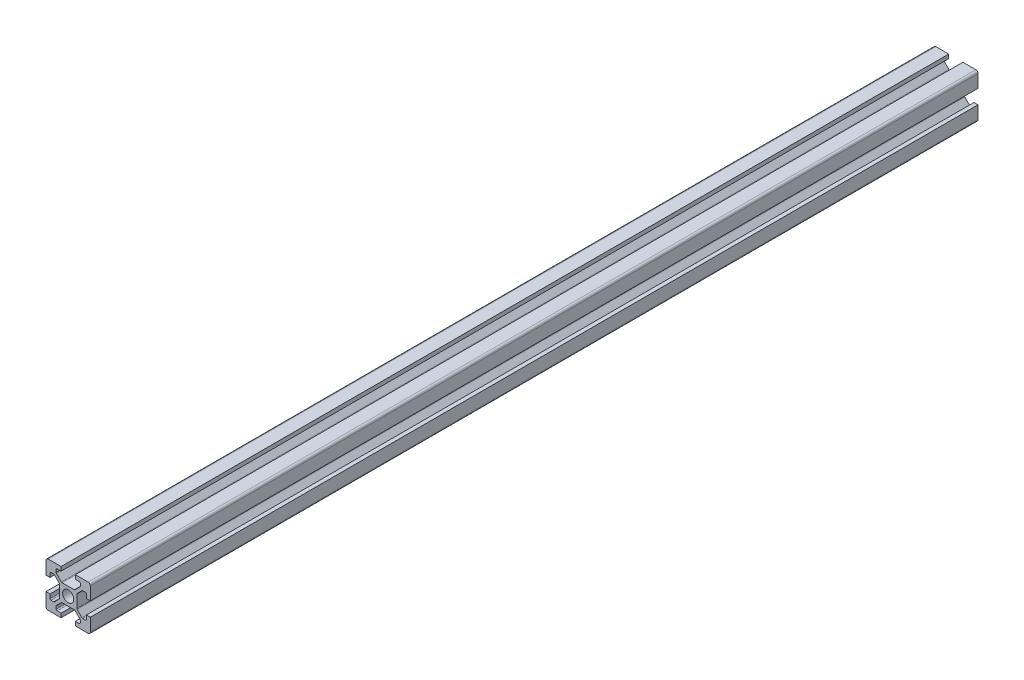
from build123d import *

# Parameters (mm, degrees)
SKETCH1_R           = 2.5
BOSS_EXTRUDE1_DEPTH = 400
FILLET1_R           = 1
FILLET2_R           = 0.5
FILLET3_R           = 0.5
FILLET4_R           = 0.5
FILLET5_R           = 0.5
CUT_EXTRUDE1_REACH  = 403.218
SKETCH2_R           = 2.5


with BuildPart() as part:
    # Sketch1 → Boss-Extrude1 (new body)
    with BuildSketch(Plane.XY):
        Polygon((13.2, 0), (13.2, 1.8), (15.45, 1.8), (15.45, 3.6), (12.95, 6.1), (7.05, 6.1), (4.55, 3.6), (4.55, 1.8), (6.8, 1.8), (6.8, 0), (0, 0), (0, 6.8), (1.8, 6.8), (1.8, 4.55), (3.6, 4.55), (6.1, 7.05), (6.1, 12.95), (3.6, 15.45), (1.8, 15.45), (1.8, 13.2), (0, 13.2), (0, 20), (6.8, 20), (6.8, 18.2), (4.55, 18.2), (4.55, 16.4), (7.05, 13.9), (12.95, 13.9), (15.45, 16.4), (15.45, 18.2), (13.2, 18.2), (13.2, 20), (20, 20), (20, 13.2), (18.2, 13.2), (18.2, 15.45), (16.4, 15.45), (13.9, 12.95), (13.9, 7.05), (16.4, 4.55), (18.2, 4.55), (18.2, 6.8), (20, 6.8), (20, 0), align=None)
        with Locations((10, 10)):
            Circle(SKETCH1_R, mode=Mode.SUBTRACT)
    extrude(amount=BOSS_EXTRUDE1_DEPTH)

    # Fillet1
    fillet1_edges = [part.edges().sort_by_distance(p)[0] for p in [
        (0, 0, 200),
        (0, 20, 200),
        (20, 20, 200),
        (20, 0, 200),
    ]]
    fillet(fillet1_edges, radius=FILLET1_R)

    # Fillet2
    fillet2_edges = [part.edges().sort_by_distance(p)[0] for p in [
        (4.55, 18.2, 200),
        (4.55, 16.4, 200),
        (7.05, 13.9, 200),
        (12.95, 13.9, 200),
        (15.45, 16.4, 200),
        (15.45, 18.2, 200),
    ]]
    fillet(fillet2_edges, radius=FILLET2_R)

    # Fillet3
    fillet3_edges = [part.edges().sort_by_distance(p)[0] for p in [
        (18.2, 15.45, 200),
        (16.4, 15.45, 200),
        (13.9, 12.95, 200),
        (13.9, 7.05, 200),
        (16.4, 4.55, 200),
        (18.2, 4.55, 200),
    ]]
    fillet(fillet3_edges, radius=FILLET3_R)

    # Fillet4
    fillet4_edges = [part.edges().sort_by_distance(p)[0] for p in [
        (1.8, 4.55, 200),
        (3.6, 4.55, 200),
        (6.1, 7.05, 200),
        (6.1, 12.95, 200),
        (3.6, 15.45, 200),
        (1.8, 15.45, 200),
    ]]
    fillet(fillet4_edges, radius=FILLET4_R)

    # Fillet5
    fillet5_edges = [part.edges().sort_by_distance(p)[0] for p in [
        (15.45, 1.8, 200),
        (15.45, 3.6, 200),
        (12.95, 6.1, 200),
        (7.05, 6.1, 200),
        (4.55, 3.6, 200),
        (4.55, 1.8, 200),
    ]]
    fillet(fillet5_edges, radius=FILLET5_R)

    # Cut-Extrude1: up to this face of the body (flat: up to its plane)
    cut_extrude1_end = Plane(part.part.faces().sort_by_distance((10, 6.1, 200))[0])
    # Sketch2 → Cut-Extrude1 (cut, up to the picked face)
    with BuildSketch(Plane(origin=(0, 24, 0), x_dir=(1, 0, 0), z_dir=(0, 1, 0)), mode=Mode.PRIVATE) as cut_extrude1_sk1:
        with Locations((10, -10)):
            Circle(SKETCH2_R)
    cut_extrude1_tool1 = split(extrude(cut_extrude1_sk1.sketch, amount=-CUT_EXTRUDE1_REACH, mode=Mode.PRIVATE), bisect_by=cut_extrude1_end, keep=Keep.BOTH, mode=Mode.PRIVATE)
    # Sketch2 → Cut-Extrude1 (cut, up to the picked face)
    with BuildSketch(Plane(origin=(0, 24, 0), x_dir=(1, 0, 0), z_dir=(0, 1, 0)), mode=Mode.PRIVATE) as cut_extrude1_sk2:
        with Locations((10, -390)):
            Circle(SKETCH2_R)
    cut_extrude1_tool2 = split(extrude(cut_extrude1_sk2.sketch, amount=-CUT_EXTRUDE1_REACH, mode=Mode.PRIVATE), bisect_by=cut_extrude1_end, keep=Keep.BOTH, mode=Mode.PRIVATE)
    add(cut_extrude1_tool1.solids().sort_by(Axis((10, 24, 10), (0, -1, 0)))[0], mode=Mode.SUBTRACT)
    add(cut_extrude1_tool2.solids().sort_by(Axis((10, 24, 390), (0, -1, 0)))[0], mode=Mode.SUBTRACT)


solid = part.part
